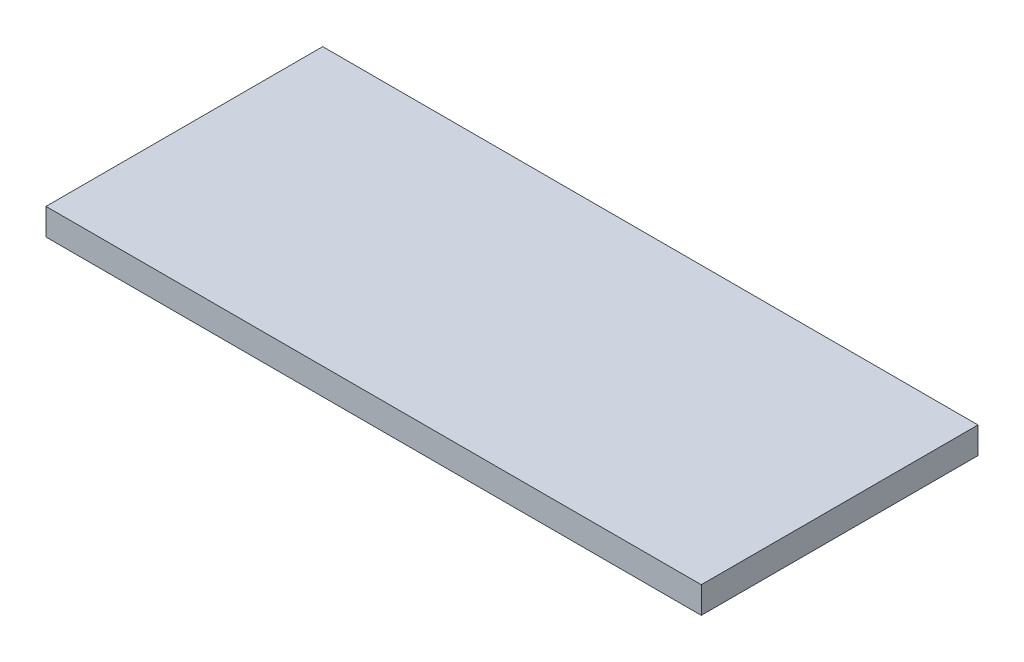
from build123d import *

# Parameters (mm, degrees)
SKETCH1_W           = 148
SKETCH1_H           = 62.5
BOSS_EXTRUDE1_DEPTH = 6


with BuildPart() as part:
    # Sketch1 → Boss-Extrude1 (new body)
    with BuildSketch(Plane(origin=(0, 0, 0), x_dir=(1, 0, 0), z_dir=(0, 1, 0))):
        with Locations((0, 31.25)):
            Rectangle(SKETCH1_W, SKETCH1_H)
    extrude(amount=BOSS_EXTRUDE1_DEPTH)


solid = part.part
